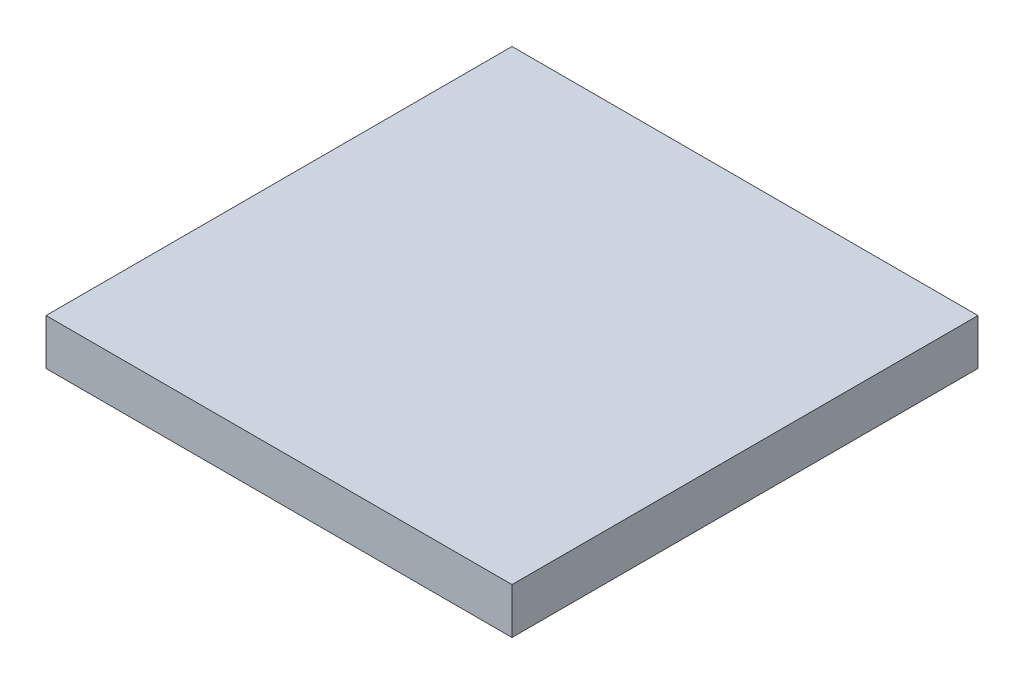
from build123d import *

# Parameters (mm, degrees)
SKETCH1_W           = 101.6
SKETCH1_H           = 101.6
BOSS_EXTRUDE1_DEPTH = 10
SKETCH2_R           = 3.175
CUT_EXTRUDE1_DEPTH  = 5


with BuildPart() as part:
    # Sketch1 → Boss-Extrude1 (new body)
    with BuildSketch(Plane(origin=(0, 0, 0), x_dir=(1, 0, 0), z_dir=(0, 1, 0))):
        Rectangle(SKETCH1_W, SKETCH1_H)
    extrude(amount=BOSS_EXTRUDE1_DEPTH)

    # Sketch2 → Cut-Extrude1 (cut)
    with BuildSketch(Plane(origin=(0, 0, 0), x_dir=(-1, 0, 0), z_dir=(0, -1, 0))):
        with Locations(Location((0, 0, 0), (0, 0, 90))):
            Circle(SKETCH2_R)
    extrude(amount=-CUT_EXTRUDE1_DEPTH, mode=Mode.SUBTRACT)


solid = part.part
